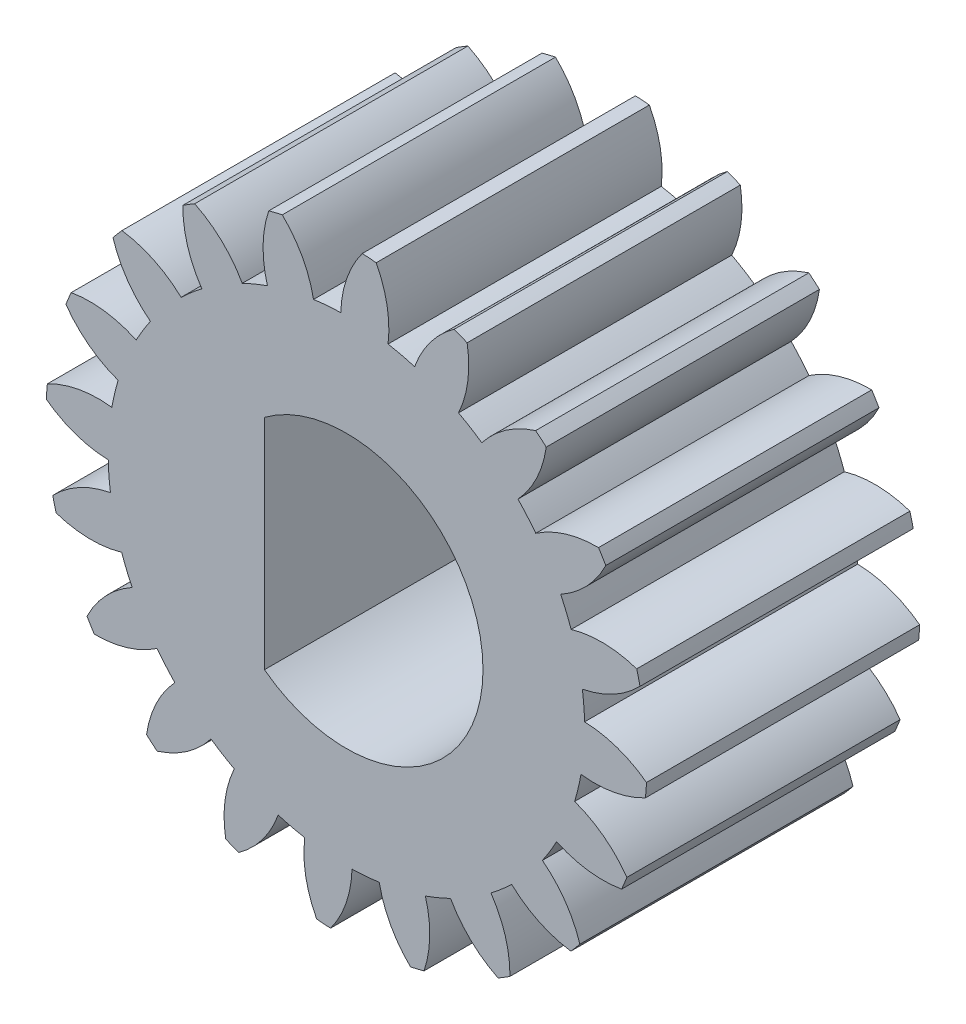
from build123d import *

# Parameters (mm, degrees)
BOSS_EXTRUDE1_DEPTH = 6.35


with BuildPart() as part:
    # Sketch1 → Boss-Extrude1 (new body)
    with BuildSketch(Plane.XY):
        with BuildLine():
            ThreePointArc((5.8600974, 3.801247619), (5.096802915, 3.692613372), (4.401264234, 3.359978717))
            ThreePointArc((4.401264234, 3.359978717), (4.201500823, 3.606656994), (3.987930607, 3.841483218))
            ThreePointArc((3.987930607, 3.841483218), (4.422090523, 4.478605685), (4.645099136, 5.216634837))
            ThreePointArc((4.645099136, 5.216634837), (4.523078796, 5.32277965), (4.398633704, 5.426071004))
            ThreePointArc((4.398633704, 5.426071004), (3.706267339, 5.086882728), (3.147560505, 4.555595099))
            ThreePointArc((3.147560505, 4.555595099), (2.881346432, 4.728469793), (2.605663792, 4.885805977))
            ThreePointArc((2.605663792, 4.885805977), (2.82169274, 5.625908243), (2.805722984, 6.396729128))
            ThreePointArc((2.805722984, 6.396729128), (2.656874194, 6.459972486), (2.506601094, 6.519752753))
            ThreePointArc((2.506601094, 6.519752753), (1.952936493, 5.983212559), (1.585751624, 5.305278091))
            ThreePointArc((1.585751624, 5.305278091), (1.279145776, 5.387427022), (0.968336451, 5.451872005))
            ThreePointArc((0.968336451, 5.451872005), (0.945088011, 6.222507704), (0.691703118, 6.950667004))
            ThreePointArc((0.691703118, 6.950667004), (0.530596234, 6.964818206), (0.369204905, 6.975235676))
            ThreePointArc((0.369204905, 6.975235676), (0.008438615, 6.293863858), (-0.131281675, 5.5356435))
            ThreePointArc((-0.131281675, 5.5356435), (-0.44826658, 5.519025359), (-0.763778409, 5.484270816))
            ThreePointArc((-0.763778409, 5.484270816), (-1.024028517, 6.210004756), (-1.490025469, 6.824225165))
            ThreePointArc((-1.490025469, 6.824225165), (-1.647620183, 6.787898993), (-1.804331633, 6.747933933))
            ThreePointArc((-1.804331633, 6.747933933), (-1.936885292, 5.98842791), (-1.835464209, 5.224141554))
            ThreePointArc((-1.835464209, 5.224141554), (-2.13179948, 5.11038304), (-2.421129317, 4.979830988))
            ThreePointArc((-2.421129317, 4.979830988), (-2.892905998, 5.589623275), (-3.525899981, 6.02978062))
            ThreePointArc((-3.525899981, 6.02978062), (-3.664556056, 5.946532932), (-3.801247619, 5.8600974))
            ThreePointArc((-3.801247619, 5.8600974), (-3.692613372, 5.096802915), (-3.359978717, 4.401264234))
            ThreePointArc((-3.359978717, 4.401264234), (-3.606656994, 4.201500823), (-3.841483218, 3.987930607))
            ThreePointArc((-3.841483218, 3.987930607), (-4.478605685, 4.422090523), (-5.216634837, 4.645099136))
            ThreePointArc((-5.216634837, 4.645099136), (-5.32277965, 4.523078796), (-5.426071004, 4.398633704))
            ThreePointArc((-5.426071004, 4.398633704), (-5.086882728, 3.706267339), (-4.555595099, 3.147560505))
            ThreePointArc((-4.555595099, 3.147560505), (-4.728469793, 2.881346432), (-4.885805977, 2.605663792))
            ThreePointArc((-4.885805977, 2.605663792), (-5.625908243, 2.82169274), (-6.396729128, 2.805722984))
            ThreePointArc((-6.396729128, 2.805722984), (-6.459972486, 2.656874194), (-6.519752753, 2.506601094))
            ThreePointArc((-6.519752753, 2.506601094), (-5.983212559, 1.952936493), (-5.305278091, 1.585751624))
            ThreePointArc((-5.305278091, 1.585751624), (-5.387427022, 1.279145776), (-5.451872005, 0.968336451))
            ThreePointArc((-5.451872005, 0.968336451), (-6.222507704, 0.945088011), (-6.950667004, 0.691703118))
            ThreePointArc((-6.950667004, 0.691703118), (-6.964818206, 0.530596234), (-6.975235676, 0.369204905))
            ThreePointArc((-6.975235676, 0.369204905), (-6.293863858, 0.008438615), (-5.5356435, -0.131281675))
            ThreePointArc((-5.5356435, -0.131281675), (-5.519025359, -0.44826658), (-5.484270816, -0.763778409))
            ThreePointArc((-5.484270816, -0.763778409), (-6.210004756, -1.024028517), (-6.824225165, -1.490025469))
            ThreePointArc((-6.824225165, -1.490025469), (-6.787898993, -1.647620183), (-6.747933933, -1.804331633))
            ThreePointArc((-6.747933933, -1.804331633), (-5.98842791, -1.936885292), (-5.224141554, -1.835464209))
            ThreePointArc((-5.224141554, -1.835464209), (-5.11038304, -2.13179948), (-4.979830988, -2.421129317))
            ThreePointArc((-4.979830988, -2.421129317), (-5.589623275, -2.892905998), (-6.02978062, -3.525899981))
            ThreePointArc((-6.02978062, -3.525899981), (-5.946532932, -3.664556056), (-5.8600974, -3.801247619))
            ThreePointArc((-5.8600974, -3.801247619), (-5.096802915, -3.692613372), (-4.401264234, -3.359978717))
            ThreePointArc((-4.401264234, -3.359978717), (-4.201500823, -3.606656994), (-3.987930607, -3.841483218))
            ThreePointArc((-3.987930607, -3.841483218), (-4.422090523, -4.478605685), (-4.645099136, -5.216634837))
            ThreePointArc((-4.645099136, -5.216634837), (-4.523078796, -5.32277965), (-4.398633704, -5.426071004))
            ThreePointArc((-4.398633704, -5.426071004), (-3.706267339, -5.086882728), (-3.147560505, -4.555595099))
            ThreePointArc((-3.147560505, -4.555595099), (-2.881346432, -4.728469793), (-2.605663792, -4.885805977))
            ThreePointArc((-2.605663792, -4.885805977), (-2.82169274, -5.625908243), (-2.805722984, -6.396729128))
            ThreePointArc((-2.805722984, -6.396729128), (-2.656874194, -6.459972486), (-2.506601094, -6.519752753))
            ThreePointArc((-2.506601094, -6.519752753), (-1.952936493, -5.983212559), (-1.585751624, -5.305278091))
            ThreePointArc((-1.585751624, -5.305278091), (-1.279145776, -5.387427022), (-0.968336451, -5.451872005))
            ThreePointArc((-0.968336451, -5.451872005), (-0.945088011, -6.222507704), (-0.691703118, -6.950667004))
            ThreePointArc((-0.691703118, -6.950667004), (-0.530596234, -6.964818206), (-0.369204905, -6.975235676))
            ThreePointArc((-0.369204905, -6.975235676), (-0.008438615, -6.293863858), (0.131281675, -5.5356435))
            ThreePointArc((0.131281675, -5.5356435), (0.44826658, -5.519025359), (0.763778409, -5.484270816))
            ThreePointArc((0.763778409, -5.484270816), (1.024028517, -6.210004756), (1.490025469, -6.824225165))
            ThreePointArc((1.490025469, -6.824225165), (1.647620183, -6.787898993), (1.804331633, -6.747933933))
            ThreePointArc((1.804331633, -6.747933933), (1.936885292, -5.98842791), (1.835464209, -5.224141554))
            ThreePointArc((1.835464209, -5.224141554), (2.13179948, -5.11038304), (2.421129317, -4.979830988))
            ThreePointArc((2.421129317, -4.979830988), (2.892905998, -5.589623275), (3.525899981, -6.02978062))
            ThreePointArc((3.525899981, -6.02978062), (3.664556056, -5.946532932), (3.801247619, -5.8600974))
            ThreePointArc((3.801247619, -5.8600974), (3.692613372, -5.096802915), (3.359978717, -4.401264234))
            ThreePointArc((3.359978717, -4.401264234), (3.606656994, -4.201500823), (3.841483218, -3.987930607))
            ThreePointArc((3.841483218, -3.987930607), (4.478605685, -4.422090523), (5.216634837, -4.645099136))
            ThreePointArc((5.216634837, -4.645099136), (5.32277965, -4.523078796), (5.426071004, -4.398633704))
            ThreePointArc((5.426071004, -4.398633704), (5.086882728, -3.706267339), (4.555595099, -3.147560505))
            ThreePointArc((4.555595099, -3.147560505), (4.728469793, -2.881346432), (4.885805977, -2.605663792))
            ThreePointArc((4.885805977, -2.605663792), (5.625908243, -2.82169274), (6.396729128, -2.805722984))
            ThreePointArc((6.396729128, -2.805722984), (6.459972486, -2.656874194), (6.519752753, -2.506601094))
            ThreePointArc((6.519752753, -2.506601094), (5.983212559, -1.952936493), (5.305278091, -1.585751624))
            ThreePointArc((5.305278091, -1.585751624), (5.387427022, -1.279145776), (5.451872005, -0.968336451))
            ThreePointArc((5.451872005, -0.968336451), (6.222507704, -0.945088011), (6.950667004, -0.691703118))
            ThreePointArc((6.950667004, -0.691703118), (6.964818206, -0.530596234), (6.975235676, -0.369204905))
            ThreePointArc((6.975235676, -0.369204905), (6.293863858, -0.008438615), (5.5356435, 0.131281675))
            ThreePointArc((5.5356435, 0.131281675), (5.519025359, 0.44826658), (5.484270816, 0.763778409))
            ThreePointArc((5.484270816, 0.763778409), (6.210004756, 1.024028517), (6.824225165, 1.490025469))
            ThreePointArc((6.824225165, 1.490025469), (6.787898993, 1.647620183), (6.747933933, 1.804331633))
            ThreePointArc((6.747933933, 1.804331633), (5.98842791, 1.936885292), (5.224141554, 1.835464209))
            ThreePointArc((5.224141554, 1.835464209), (5.11038304, 2.13179948), (4.979830988, 2.421129317))
            ThreePointArc((4.979830988, 2.421129317), (5.589623275, 2.892905998), (6.02978062, 3.525899981))
            ThreePointArc((6.02978062, 3.525899981), (5.946532932, 3.664556056), (5.8600974, 3.801247619))
        make_face()
        with BuildLine():
            Line((-1.905, 2.54), (-1.905, -2.54))
            ThreePointArc((-1.905, -2.54), (3.175, 0), (-1.905, 2.54))
        make_face(mode=Mode.SUBTRACT)
    extrude(amount=BOSS_EXTRUDE1_DEPTH)


solid = part.part
